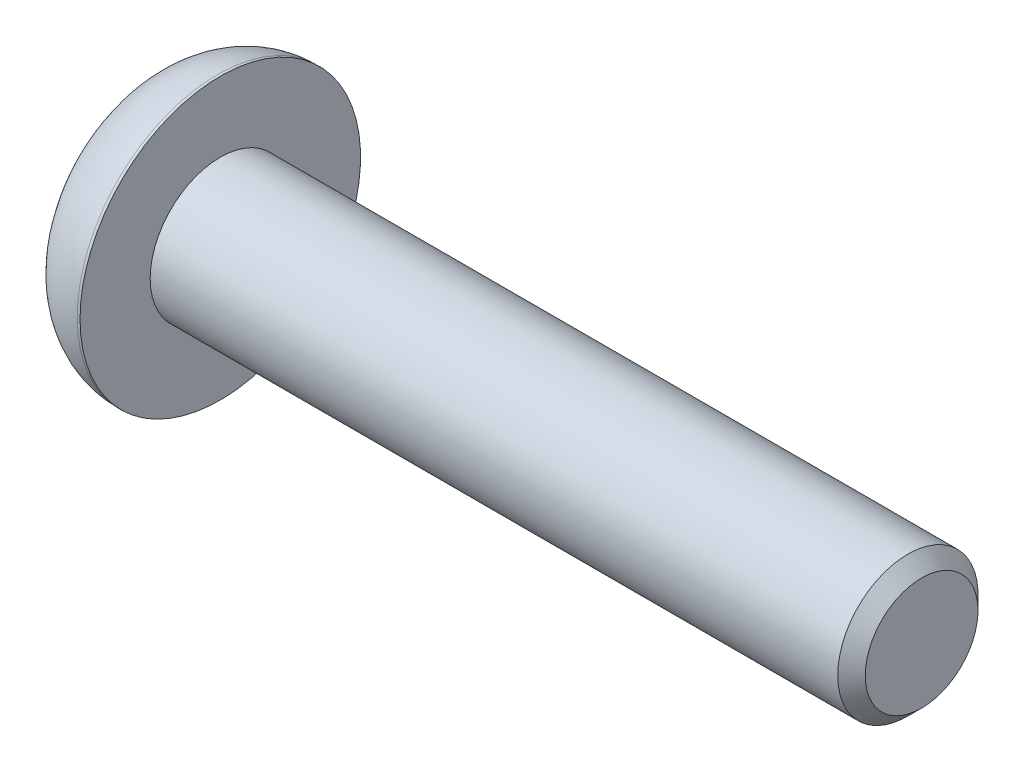
from build123d import *

# Parameters (mm, degrees)
SKETCH_1_W                = 2.8
SKETCH_1_H                = 5
SKETCH_2_R                = 2.5
EXTRUDE_1_DEPTH           = 25
CUT_EXTRUDE_1_DEPTH       = 1.82
HOLE_WIZARD_3_0_3_1_D     = 3
HOLE_WIZARD_3_0_3_1_DEPTH = 0.113974596
HOLE_WIZARD_3_0_3_1_TIP   = 0.866025404
CHAMFER_1_SIZE            = 0.4905
FILLET_1_R                = 2.7


with BuildPart() as part:
    # Эскиз1 → Повернуть1 (revolve)
    with BuildSketch(Plane(origin=(0, 0, 0), x_dir=(-1, 0, 0), z_dir=(0, 0, -1)), mode=Mode.PRIVATE) as revolve_1_sk:
        with Locations((-1.4, 2.5)):
            Rectangle(SKETCH_1_W, SKETCH_1_H)
    revolve(revolve_1_sk.sketch.rotate(Axis((2.8, 0, 0), (-1, 0, 0)), 270), axis=Axis((2.8, 0, 0), (-1, 0, 0)))

    # Эскиз2 → Бобышка-Вытянуть1 (add)
    with BuildSketch(Plane(origin=(2.8, 0, 0), x_dir=(0, 0, -1), z_dir=(1, 0, 0))):
        Circle(SKETCH_2_R)
    extrude(amount=EXTRUDE_1_DEPTH)

    # Эскиз3 → Вырез-Вытянуть1 (cut)
    with BuildSketch(Plane.ZY):
        Polygon((0, 1.732050808), (-1.5, 0.866025404), (-1.5, -0.866025404), (0, -1.732050808), (1.5, -0.866025404), (1.5, 0.866025404), align=None)
    extrude(amount=-CUT_EXTRUDE_1_DEPTH, mode=Mode.SUBTRACT)

    # Диаметр отверстия Ø3.0 (3)1
    with Locations(Plane.ZY.offset(-1.82)):
        with Locations((0, 0)):
            Hole(HOLE_WIZARD_3_0_3_1_D / 2, depth=HOLE_WIZARD_3_0_3_1_DEPTH)
            with Locations((0, 0, -(HOLE_WIZARD_3_0_3_1_DEPTH + HOLE_WIZARD_3_0_3_1_TIP / 2))):  # 120° drill point
                Cone(0, HOLE_WIZARD_3_0_3_1_D / 2, HOLE_WIZARD_3_0_3_1_TIP, mode=Mode.SUBTRACT)

    # Фаска1
    chamfer_1_edges = [part.edges().sort_by_distance(p)[0] for p in [
        (27.8, 0, 2.5),
    ]]
    chamfer(chamfer_1_edges, length=CHAMFER_1_SIZE)

    # Скругление1
    fillet_1_edges = [part.edges().sort_by_distance(p)[0] for p in [
        (0, 0, -5),
    ]]
    fillet(fillet_1_edges, radius=FILLET_1_R)


solid = part.part
